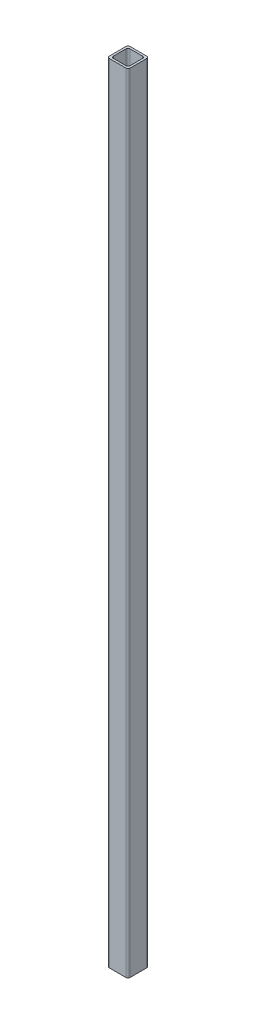
from build123d import *

# Parameters (mm, degrees)
BOSS_EXTRUDE1_START = -2175.918735
BOSS_EXTRUDE1_DEPTH = 379.319789155


with BuildPart() as part:
    # Sketch1 → Boss-Extrude1 (new body)
    with BuildSketch(Plane(origin=(0, 0, 0), x_dir=(1, 0, 0), z_dir=(0, 1, 0)).offset(BOSS_EXTRUDE1_START)):
        with BuildLine():
            Line((-51.887039023, -1.543455886), (-43.887039023, -1.543455886))
            ThreePointArc((-43.887039023, -1.543455886), (-43.179932241, -1.836349105), (-42.887039023, -2.543455886))
            Line((-42.887039023, -2.543455886), (-42.887039023, -10.543455886))
            ThreePointArc((-42.887039023, -10.543455886), (-43.179932241, -11.250562667), (-43.887039023, -11.543455886))
            Line((-43.887039023, -11.543455886), (-51.887039023, -11.543455886))
            ThreePointArc((-51.887039023, -11.543455886), (-52.594145804, -11.250562667), (-52.887039023, -10.543455886))
            Line((-52.887039023, -10.543455886), (-52.887039023, -2.543455886))
            ThreePointArc((-52.887039023, -2.543455886), (-52.594145804, -1.836349105), (-51.887039023, -1.543455886))
        make_face()
        with BuildLine():
            Line((-50.887039023, -2.543455886), (-44.887039023, -2.543455886))
            ThreePointArc((-44.887039023, -2.543455886), (-44.179932241, -2.836349105), (-43.887039023, -3.543455886))
            Line((-43.887039023, -3.543455886), (-43.887039023, -9.543455886))
            ThreePointArc((-43.887039023, -9.543455886), (-44.179932241, -10.250562667), (-44.887039023, -10.543455886))
            Line((-44.887039023, -10.543455886), (-50.887039023, -10.543455886))
            ThreePointArc((-50.887039023, -10.543455886), (-51.594145804, -10.250562667), (-51.887039023, -9.543455886))
            Line((-51.887039023, -9.543455886), (-51.887039023, -3.543455886))
            ThreePointArc((-51.887039023, -3.543455886), (-51.594145804, -2.836349105), (-50.887039023, -2.543455886))
        make_face(mode=Mode.SUBTRACT)
    extrude(amount=-BOSS_EXTRUDE1_DEPTH)


solid = part.part
